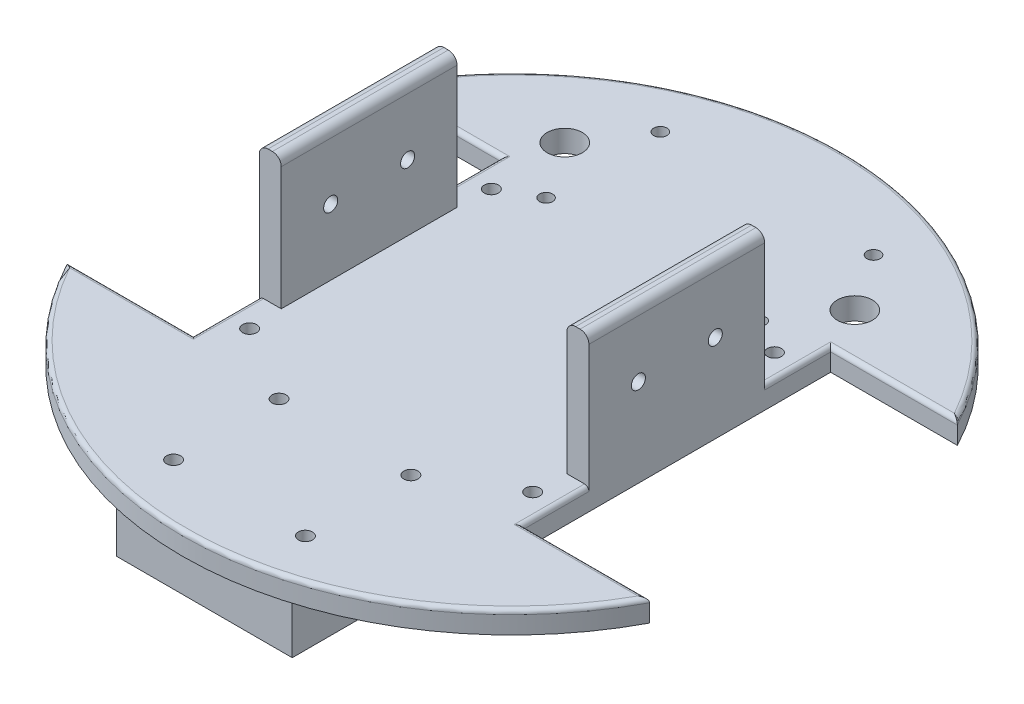
from build123d import *

# Parameters (mm, degrees)
SKETCH1_R           = 75
BOSS_EXTRUDE2_DEPTH = 5
SKETCH5_W           = 35
SKETCH5_H           = 70
CUT_EXTRUDE1_DEPTH  = 107.183802908
SKETCH6_W           = 5
SKETCH6_H           = 40
BOSS_EXTRUDE3_DEPTH = 30
SKETCH7_R           = 1.6
CUT_EXTRUDE2_DEPTH  = 136.669635512
SKETCH8_W           = 40
SKETCH8_H           = 40
BOSS_EXTRUDE5_DEPTH = 12.5
SKETCH9_R           = 1.6
CUT_EXTRUDE3_DEPTH  = 111.820801297
SKETCH10_R          = 1.6
SKETCH10_R_2        = 4
CUT_EXTRUDE8_DEPTH  = 105.522724802
SKETCH13_R          = 1.5
CUT_EXTRUDE9_DEPTH  = 105.522724802
FILLET1_R           = 1
FILLET2_R           = 2


with BuildPart() as part:
    # Sketch1 → Boss-Extrude2 (new body)
    with BuildSketch(Plane(origin=(0, 0, 0), x_dir=(1, 0, 0), z_dir=(0, 1, 0))):
        with Locations(Location((0, 0, 0), (0, 0, 270))):
            Circle(SKETCH1_R)
    extrude(amount=BOSS_EXTRUDE2_DEPTH)

    # Sketch5 → Cut-Extrude1 (cut, through all)
    with BuildSketch(Plane(origin=(0, 5, 0), x_dir=(1, 0, 0), z_dir=(0, 1, 0))):
        with Locations((55, 0)):
            Rectangle(SKETCH5_W, SKETCH5_H)
        with Locations((-55, 0)):
            Rectangle(SKETCH5_W, SKETCH5_H)
    extrude(amount=-CUT_EXTRUDE1_DEPTH, mode=Mode.SUBTRACT)


with BuildPart() as cut_extrude1_piece_1:
    # of the separate pieces the step leaves, piece 1, a body of its own (cut_extrude1_pieces)
    add(part.part.solids().sort_by_distance((-66.332495807, 0, 35))[0])

    # Sketch6 → Boss-Extrude3 (add)
    with BuildSketch(Plane(origin=(0, 5, 0), x_dir=(1, 0, 0), z_dir=(0, 1, 0))):
        with Locations((-35, 0)):
            Rectangle(SKETCH6_W, SKETCH6_H)
    boss_extrude3 = extrude(amount=BOSS_EXTRUDE3_DEPTH)

    # Sketch7 → Cut-Extrude2 (cut, through all)
    with BuildSketch(Plane(origin=(-32.5, 0, 0), x_dir=(0, 0, -1), z_dir=(1, 0, 0))):
        with Locations((-8.75, 20)):
            Circle(SKETCH7_R)
        with Locations((8.75, 20)):
            Circle(SKETCH7_R)
    cut_extrude2 = extrude(amount=-CUT_EXTRUDE2_DEPTH, mode=Mode.SUBTRACT)

    # Mirror1: Boss-Extrude3, Cut-Extrude2 across plane
    add(boss_extrude3.mirror(Plane(origin=(0, 0, 0), x_dir=(0, 0, 1), z_dir=(1, 0, 0))))
    add(cut_extrude2.mirror(Plane(origin=(0, 0, 0), x_dir=(0, 0, 1), z_dir=(1, 0, 0))), mode=Mode.SUBTRACT)

    # Sketch8 → Boss-Extrude5 (add)
    with BuildSketch(Plane.XZ):
        with Locations((0, 50)):
            Rectangle(SKETCH8_W, SKETCH8_H)
    extrude(amount=BOSS_EXTRUDE5_DEPTH)

    # Sketch9 → Cut-Extrude3 (cut, through all)
    with BuildSketch(Plane.XZ.offset(12.5)):
        with Locations(Location((-15, 62, 0), (0, 0, 270))):
            Circle(SKETCH9_R)
        with Locations(Location((15, 62, 0), (0, 0, 270))):
            Circle(SKETCH9_R)
        with Locations(Location((-15, 38, 0), (0, 0, 270))):
            Circle(SKETCH9_R)
        with Locations(Location((15, 38, 0), (0, 0, 270))):
            Circle(SKETCH9_R)
    extrude(amount=-CUT_EXTRUDE3_DEPTH, mode=Mode.SUBTRACT)

    # Sketch10 → Cut-Extrude8 (cut, through all)
    with BuildSketch(Plane(origin=(0, 5, 0), x_dir=(1, 0, 0), z_dir=(0, 1, 0))):
        with Locations(Location((32.2, 27.5, 0), (0, 0, 270))):
            Circle(SKETCH10_R)
        with Locations(Location((-32.2, 27.5, 0), (0, 0, 270))):
            Circle(SKETCH10_R)
        with Locations(Location((-32.2, -27.5, 0), (0, 0, 270))):
            Circle(SKETCH10_R)
        with Locations(Location((32.2, -27.5, 0), (0, 0, 270))):
            Circle(SKETCH10_R)
        with Locations(Location((-33, 45, 0), (0, 0, 270))):
            Circle(SKETCH10_R_2)
        with Locations(Location((33, 45, 0), (0, 0, 270))):
            Circle(SKETCH10_R_2)
    extrude(amount=-CUT_EXTRUDE8_DEPTH, mode=Mode.SUBTRACT)

    # Sketch13 → Cut-Extrude9 (cut, through all)
    with BuildSketch(Plane(origin=(0, 5, 0), x_dir=(1, 0, 0), z_dir=(0, 1, 0))):
        with Locations(Location((24.25, 58, 0), (0, 0, 270))):
            Circle(SKETCH13_R)
        with Locations(Location((-24.25, 58, 0), (0, 0, 270))):
            Circle(SKETCH13_R)
        with Locations(Location((-24.25, 32, 0), (0, 0, 270))):
            Circle(SKETCH13_R)
        with Locations(Location((24.25, 32, 0), (0, 0, 270))):
            Circle(SKETCH13_R)
    extrude(amount=-CUT_EXTRUDE9_DEPTH, mode=Mode.SUBTRACT)

    # Fillet1
    fillet1_edges = [cut_extrude1_piece_1.edges().sort_by_distance(p)[0] for p in [
        (0, 5, -75),
        (0, 5, 75),
        (51.916247904, 5, 35),
        (51.916247904, 5, -35),
        (37.5, 5, -27.5),
        (-51.916247904, 5, -35),
        (-51.916247904, 5, 35),
        (-37.5, 5, 27.5),
        (-37.5, 5, -27.5),
        (37.5, 5, 27.5),
    ]]
    fillet(fillet1_edges, radius=FILLET1_R)

    # Fillet2
    fillet2_edges = [cut_extrude1_piece_1.edges().sort_by_distance(p)[0] for p in [
        (-37.5, 35, 0),
        (-32.5, 35, 0),
        (37.5, 35, 0),
        (32.5, 35, 0),
    ]]
    fillet(fillet2_edges, radius=FILLET2_R)


with BuildPart() as cut_extrude1_piece_2:
    # of the separate pieces the step leaves, piece 2, a body of its own (cut_extrude1_pieces)
    add(part.part.solids().sort_by_distance((-72.5, 0, -19.20286437))[0])


with BuildPart() as cut_extrude1_piece_3:
    # of the separate pieces the step leaves, piece 3, a body of its own (cut_extrude1_pieces)
    add(part.part.solids().sort_by_distance((72.5, 0, 19.20286437))[0])


solid = cut_extrude1_piece_1.part
